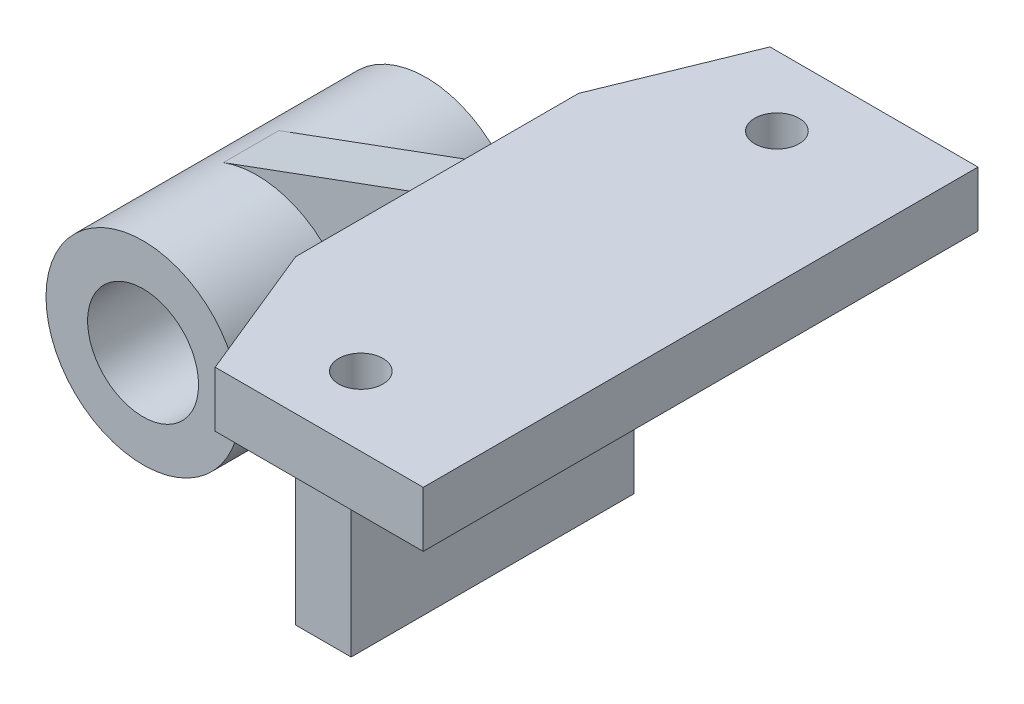
from build123d import *
from build123d.topology import SkipClean

# Parameters (mm, degrees)
SKETCH1_R           = 4
BOSS_EXTRUDE1_DEPTH = 20.4
CUT_EXTRUDE3_START  = -2
CUT_EXTRUDE3_DEPTH  = 32.708900902
CUT_EXTRUDE4_START  = 2
CUT_EXTRUDE4_DEPTH  = 32.708900902
BOSS_EXTRUDE2_DEPTH = 4
CUT_EXTRUDE5_REACH  = 50.384
SKETCH7_R           = 1.6


with BuildPart() as part:
    # Sketch1 → Boss-Extrude1 (new body)
    with BuildSketch(Plane.XY):
        with BuildLine():
            Line((-2.414508498, -6.570399433), (11, -11.5))
            Line((11, -11.5), (15, -11.5))
            Line((15, -11.5), (15, 7.5))
            Line((15, 7.5), (30, 7.5))
            Line((30, 7.5), (30, 11.5))
            Line((30, 11.5), (11, 11.5))
            Line((11, 11.5), (-2.414508498, 6.570399433))
            ThreePointArc((-2.414508498, 6.570399433), (-7, 0), (-2.414508498, -6.570399433))
        make_face()
        Circle(SKETCH1_R, mode=Mode.SUBTRACT)
    extrude(amount=BOSS_EXTRUDE1_DEPTH)

    # Sketch5 → Cut-Extrude3 (cut, through all)
    with SkipClean():  # the faces are left unmerged after this step: merging them gives an invalid solid
        with BuildSketch(Plane.XY.offset(10.2).offset(CUT_EXTRUDE3_START)):
            with BuildLine():
                Line((11, -11.5), (11, -2))
                Line((11, -2), (6.708203932, -2))
                ThreePointArc((6.708203932, -2), (3.135457361, -6.258506782), (-2.414508498, -6.570399433))
                Line((-2.414508498, -6.570399433), (11, -11.5))
            make_face()
            with BuildLine():
                Line((11, 2), (11, 11.5))
                Line((11, 11.5), (-2.414508498, 6.570399433))
                ThreePointArc((-2.414508498, 6.570399433), (3.135457361, 6.258506782), (6.708203932, 2))
                Line((6.708203932, 2), (11, 2))
            make_face()
        extrude(amount=-CUT_EXTRUDE3_DEPTH, mode=Mode.SUBTRACT)

    # Sketch5<5> → Cut-Extrude4 (cut, through all)
    with SkipClean():  # the faces are left unmerged after this step: merging them gives an invalid solid
        with BuildSketch(Plane.XY.offset(10.2).offset(CUT_EXTRUDE4_START)):
            with BuildLine():
                Line((11, -11.5), (11, -2))
                Line((11, -2), (6.708203932, -2))
                ThreePointArc((6.708203932, -2), (3.135457361, -6.258506782), (-2.414508498, -6.570399433))
                Line((-2.414508498, -6.570399433), (11, -11.5))
            make_face()
            with BuildLine():
                Line((11, 2), (11, 11.5))
                Line((11, 11.5), (-2.414508498, 6.570399433))
                ThreePointArc((-2.414508498, 6.570399433), (3.135457361, 6.258506782), (6.708203932, 2))
                Line((6.708203932, 2), (11, 2))
            make_face()
        extrude(amount=CUT_EXTRUDE4_DEPTH, mode=Mode.SUBTRACT)

    # Sketch6 → Boss-Extrude2 (add)
    with SkipClean():  # the faces are left unmerged after this step: merging them gives an invalid solid
        with BuildSketch(Plane(origin=(0, 11.5, 0), x_dir=(1, 0, 0), z_dir=(0, 1, 0))):
            Polygon((14.99930592, 9.8), (30, 9.8), (30, -30.2), (14.99930592, -30.2), (11, -20.4), (11, 0), align=None)
        extrude(amount=-BOSS_EXTRUDE2_DEPTH)

    # Sketch7 → Cut-Extrude5 (cut, up to next)
    with BuildSketch(Plane(origin=(0, 11.5, 0), x_dir=(1, 0, 0), z_dir=(0, 1, 0)), mode=Mode.PRIVATE) as cut_extrude5_sk1:
        with Locations((20.5, 4.8)):
            Circle(SKETCH7_R)
    cut_extrude5_tool1 = extrude(cut_extrude5_sk1.sketch, amount=-CUT_EXTRUDE5_REACH, mode=Mode.PRIVATE) & part.part
    # Sketch7 → Cut-Extrude5 (cut, up to next)
    with BuildSketch(Plane(origin=(0, 11.5, 0), x_dir=(1, 0, 0), z_dir=(0, 1, 0)), mode=Mode.PRIVATE) as cut_extrude5_sk2:
        with Locations((20.5, -25.2)):
            Circle(SKETCH7_R)
    cut_extrude5_tool2 = extrude(cut_extrude5_sk2.sketch, amount=-CUT_EXTRUDE5_REACH, mode=Mode.PRIVATE) & part.part
    add(cut_extrude5_tool1.solids().sort_by_distance((20.5, 11.5, -4.8))[0], mode=Mode.SUBTRACT)
    add(cut_extrude5_tool2.solids().sort_by_distance((20.5, 11.5, 25.2))[0], mode=Mode.SUBTRACT)


solid = part.part
